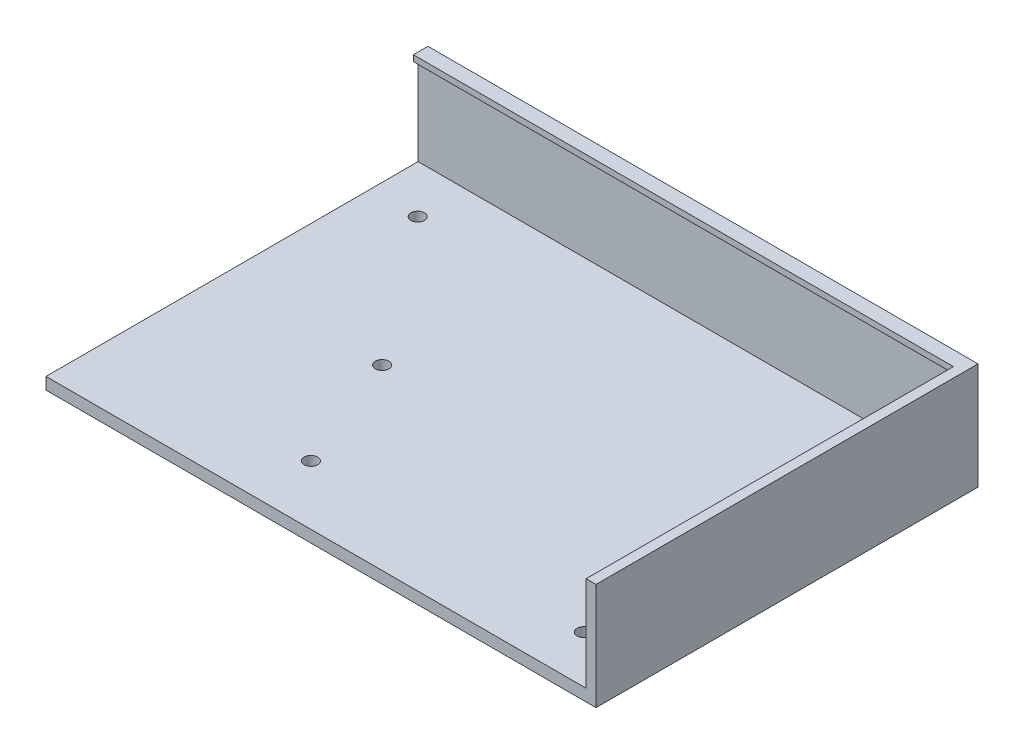
from build123d import *

# Parameters (mm, degrees)
SKETCH1_W                     = 278.2
SKETCH1_H                     = 193.2
SHELL_BLOCK_DEPTH             = 27
SKETCH2_W                     = 273.2
SKETCH2_H                     = 185.8
FRONT_OPENING_DEPTH           = 1.5
SKETCH3_W                     = 273.2
SKETCH3_H                     = 188.2
DISPLAY_POCKET_DEPTH          = 22.5
SKETCH4_W                     = 3
SKETCH4_H                     = 56
VENT_SLOTS_DEPTH              = 4
SKETCH5_W                     = 58
SKETCH5_H                     = 16
CABLE_EXIT_X_SHORT_SIDE_DEPTH = 140.1
SKETCH6_R                     = 1.7
BOLT_HOLES_DEPTH              = 4
KEEP_ONE_HALF_X_DEPTH         = 172.491603293
KEEP_ONE_HALF_X_DEPTH_BACK    = 172.491603293
SKETCH7_W                     = 200
SKETCH7_H                     = 400
KEEP_ONE_QUARTER_Z_DEPTH      = 172.491603293
KEEP_ONE_QUARTER_Z_DEPTH_BACK = 172.491603293
SKETCH8_W                     = 400
SKETCH8_H                     = 200


with BuildPart() as part:
    # Sketch1 → Shell Block (new body)
    with BuildSketch(Plane(origin=(0, 0, 0), x_dir=(1, 0, 0), z_dir=(0, 1, 0))):
        Rectangle(SKETCH1_W, SKETCH1_H)
    extrude(amount=SHELL_BLOCK_DEPTH)

    # Sketch2 → Front Opening (cut)
    with BuildSketch(Plane(origin=(0, 27, 0), x_dir=(1, 0, 0), z_dir=(0, 1, 0))):
        Rectangle(SKETCH2_W, SKETCH2_H)
    extrude(amount=-FRONT_OPENING_DEPTH, mode=Mode.SUBTRACT)

    # Sketch3 → Display Pocket (cut)
    with BuildSketch(Plane(origin=(0, 25.5, 0), x_dir=(1, 0, 0), z_dir=(0, 1, 0))):
        Rectangle(SKETCH3_W, SKETCH3_H)
    extrude(amount=-DISPLAY_POCKET_DEPTH, mode=Mode.SUBTRACT)

    # Sketch4 → Vent Slots (cut)
    with BuildSketch(Plane(origin=(0, 3, 0), x_dir=(1, 0, 0), z_dir=(0, 1, 0))):
        with Locations((-67.5, 56)):
            Rectangle(SKETCH4_W, SKETCH4_H)
        with Locations((-67.5, -56)):
            Rectangle(SKETCH4_W, SKETCH4_H)
        with Locations((-75.5, 56)):
            Rectangle(SKETCH4_W, SKETCH4_H)
        with Locations((-75.5, -56)):
            Rectangle(SKETCH4_W, SKETCH4_H)
        with Locations((-83.5, 56)):
            Rectangle(SKETCH4_W, SKETCH4_H)
        with Locations((-83.5, -56)):
            Rectangle(SKETCH4_W, SKETCH4_H)
        with Locations((-91.5, 56)):
            Rectangle(SKETCH4_W, SKETCH4_H)
        with Locations((-91.5, -56)):
            Rectangle(SKETCH4_W, SKETCH4_H)
        with Locations((-99.5, 56)):
            Rectangle(SKETCH4_W, SKETCH4_H)
        with Locations((-99.5, -56)):
            Rectangle(SKETCH4_W, SKETCH4_H)
        with Locations((-107.5, 56)):
            Rectangle(SKETCH4_W, SKETCH4_H)
        with Locations((-107.5, -56)):
            Rectangle(SKETCH4_W, SKETCH4_H)
        with Locations((-115.5, 56)):
            Rectangle(SKETCH4_W, SKETCH4_H)
        with Locations((-115.5, -56)):
            Rectangle(SKETCH4_W, SKETCH4_H)
        with Locations((-123.5, 56)):
            Rectangle(SKETCH4_W, SKETCH4_H)
        with Locations((-123.5, -56)):
            Rectangle(SKETCH4_W, SKETCH4_H)
    extrude(amount=-VENT_SLOTS_DEPTH, mode=Mode.SUBTRACT)

    # Sketch5 → Cable Exit (-X short side) (cut)
    with BuildSketch(Plane(origin=(0, 0, 0), x_dir=(0, 0, -1), z_dir=(1, 0, 0))):
        with Locations((0, 13)):
            Rectangle(SKETCH5_W, SKETCH5_H)
    extrude(amount=-CABLE_EXIT_X_SHORT_SIDE_DEPTH, mode=Mode.SUBTRACT)

    # Sketch6 → Bolt Holes (cut)
    with BuildSketch(Plane(origin=(0, 3, 0), x_dir=(1, 0, 0), z_dir=(0, 1, 0))):
        with Locations(Location((-40, -45, 0), (0, 0, 270))):
            Circle(SKETCH6_R)
        with Locations(Location((-40, 45, 0), (0, 0, 270))):
            Circle(SKETCH6_R)
        with Locations(Location((40, -45, 0), (0, 0, 270))):
            Circle(SKETCH6_R)
        with Locations(Location((40, 45, 0), (0, 0, 270))):
            Circle(SKETCH6_R)
        with Locations(Location((-52, -15, 0), (0, 0, 270))):
            Circle(SKETCH6_R)
        with Locations(Location((-52, 15, 0), (0, 0, 270))):
            Circle(SKETCH6_R)
        with Locations(Location((52, -15, 0), (0, 0, 270))):
            Circle(SKETCH6_R)
        with Locations(Location((52, 15, 0), (0, 0, 270))):
            Circle(SKETCH6_R)
        with Locations(Location((-12, -82, 0), (0, 0, 270))):
            Circle(SKETCH6_R)
        with Locations(Location((-12, 82, 0), (0, 0, 270))):
            Circle(SKETCH6_R)
        with Locations(Location((12, -82, 0), (0, 0, 270))):
            Circle(SKETCH6_R)
        with Locations(Location((12, 82, 0), (0, 0, 270))):
            Circle(SKETCH6_R)
        with Locations(Location((-124, -12, 0), (0, 0, 270))):
            Circle(SKETCH6_R)
        with Locations(Location((-124, 12, 0), (0, 0, 270))):
            Circle(SKETCH6_R)
        with Locations(Location((124, -12, 0), (0, 0, 270))):
            Circle(SKETCH6_R)
        with Locations(Location((124, 12, 0), (0, 0, 270))):
            Circle(SKETCH6_R)
    extrude(amount=-BOLT_HOLES_DEPTH, mode=Mode.SUBTRACT)

    # Sketch7 → Keep one half (X) (cut, two sides: drawn at the far end of the back side and taken through both)
    with BuildSketch(Plane(origin=(0, 0, 0), x_dir=(1, 0, 0), z_dir=(0, 1, 0)).offset(-KEEP_ONE_HALF_X_DEPTH_BACK)):
        with Locations((-100, 0)):
            Rectangle(SKETCH7_W, SKETCH7_H)
    extrude(amount=KEEP_ONE_HALF_X_DEPTH + KEEP_ONE_HALF_X_DEPTH_BACK, mode=Mode.SUBTRACT)

    # Sketch8 → Keep one quarter (Z) (cut, two sides: drawn at the far end of the back side and taken through both)
    with BuildSketch(Plane(origin=(0, 0, 0), x_dir=(1, 0, 0), z_dir=(0, 1, 0)).offset(-KEEP_ONE_QUARTER_Z_DEPTH_BACK)):
        with Locations((0, -100)):
            Rectangle(SKETCH8_W, SKETCH8_H)
    extrude(amount=KEEP_ONE_QUARTER_Z_DEPTH + KEEP_ONE_QUARTER_Z_DEPTH_BACK, mode=Mode.SUBTRACT)


solid = part.part
